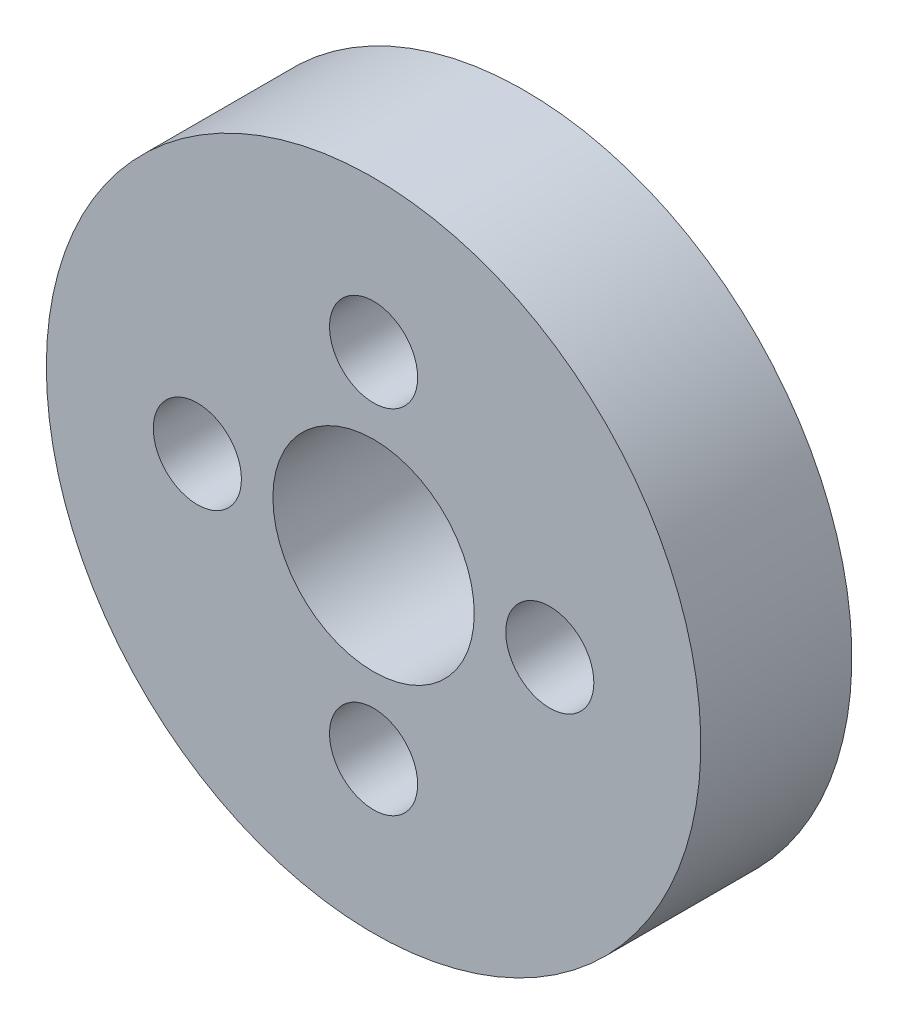
from build123d import *

# Parameters (mm, degrees)
SKETCH1_R           = 10.31875
SKETCH1_R_2         = 3.175
BOSS_EXTRUDE1_DEPTH = 4.7625
SKETCH6_R           = 1.3890625
CUT_EXTRUDE1_DEPTH  = 16.350394437


with BuildPart() as part:
    # Sketch1 → Boss-Extrude1 (new body)
    with BuildSketch(Plane.XY):
        with Locations(Location((0, 0, 0), (0, 0, 180))):
            Circle(SKETCH1_R)
        with Locations(Location((0, 0, 0), (0, 0, 180))):
            Circle(SKETCH1_R_2, mode=Mode.SUBTRACT)
    extrude(amount=BOSS_EXTRUDE1_DEPTH)

    # Sketch6 → Cut-Extrude1 (cut, through all)
    with BuildSketch(Plane.XY.offset(4.7625)):
        with Locations((0, 5.55625)):
            Circle(SKETCH6_R)
        with Locations((5.55625, 0)):
            Circle(SKETCH6_R)
        with Locations((0, -5.55625)):
            Circle(SKETCH6_R)
        with Locations((-5.55625, 0)):
            Circle(SKETCH6_R)
    extrude(amount=-CUT_EXTRUDE1_DEPTH, mode=Mode.SUBTRACT)


solid = part.part
